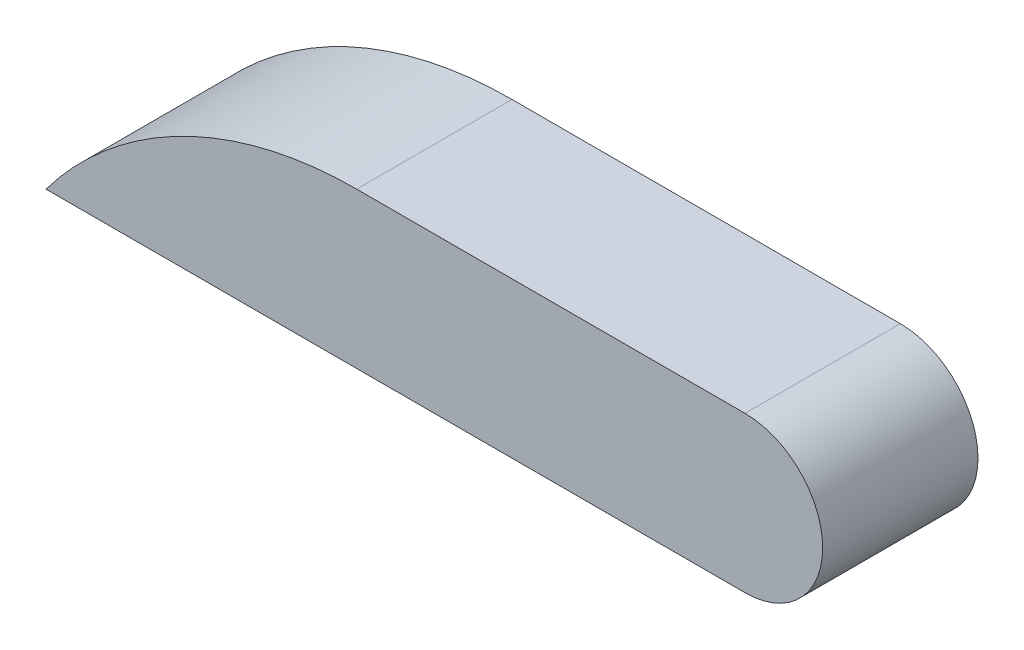
from build123d import *

# Parameters (mm, degrees)
BOSS_EXTRUDE1_DEPTH = 2.54


with BuildPart() as part:
    # Sketch1 → Boss-Extrude1 (new body)
    with BuildSketch(Plane.XY):
        with BuildLine():
            Line((11.43, 0), (0, 0))
            ThreePointArc((0, 0), (2.240193669, 1.869612663), (5.08, 2.54))
            Line((5.08, 2.54), (11.43, 2.54))
            ThreePointArc((11.43, 2.54), (12.7, 1.27), (11.43, 0))
        make_face()
    extrude(amount=BOSS_EXTRUDE1_DEPTH)


solid = part.part
